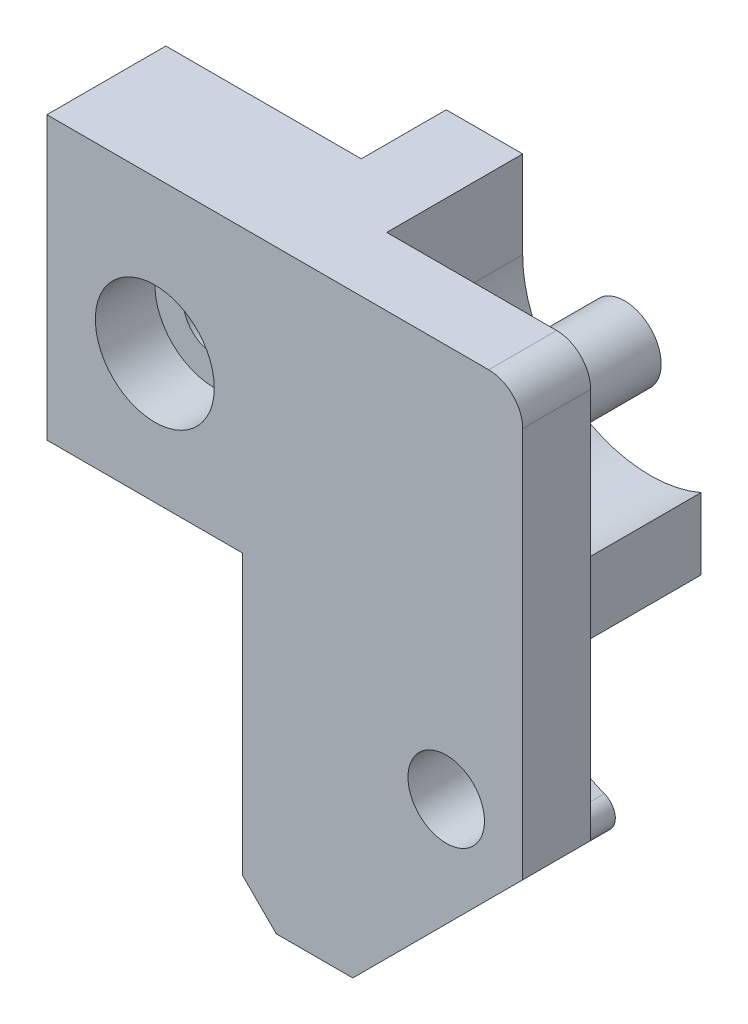
from build123d import *

# Parameters (mm, degrees)
BOSS_EXTRUDE1_DEPTH                            = 4
SKETCH2_R                                      = 2.25
CUT_EXTRUDE1_DEPTH                             = 46
SKETCH2_3_R                                    = 2.15
BOSS_EXTRUDE2_DEPTH                            = 8
BOSS_EXTRUDE4_DEPTH                            = 8
SKETCH6_W                                      = 11.5
SKETCH6_H                                      = 18.413961031
CUT_EXTRUDE2_DEPTH                             = 47.400431032
SKETCH12_W                                     = 8
SKETCH12_H                                     = 13.1
CUT_EXTRUDE3_DEPTH                             = 40.286161686
CBORE_FOR_6_SOCKET_HEAD_CAP_SCREW1_D           = 3.6576
CBORE_FOR_6_SOCKET_HEAD_CAP_SCREW1_CBORE_D     = 7
CBORE_FOR_6_SOCKET_HEAD_CAP_SCREW1_CBORE_DEPTH = 3.5052
SKETCH13_W                                     = 11.5
SKETCH13_H                                     = 16.586038969
CUT_EXTRUDE4_DEPTH                             = 5
CHAMFER1_SIZE                                  = 2
CUT_EXTRUDE5_START                             = -1.5
SKETCH14_R                                     = 2.15
CUT_EXTRUDE5_DEPTH                             = 1.5


with BuildPart() as part:
    # Sketch1 → Boss-Extrude1 (new body)
    with BuildSketch(Plane.XY):
        with BuildLine():
            Line((18, 0), (28, 10))
            Line((28, 10), (28, 33))
            ThreePointArc((28, 33), (27.414213562, 34.414213562), (26, 35))
            Line((26, 35), (0, 35))
            Line((0, 35), (0, 0))
            Line((0, 0), (18, 0))
        make_face()
    extrude(amount=BOSS_EXTRUDE1_DEPTH)

    # Sketch2 → Cut-Extrude1 (cut, through all)
    with BuildSketch(Plane(origin=(0, 0, 0), x_dir=(-1, 0, 0), z_dir=(0, 0, -1))):
        with Locations((-23.5, 11.863961031)):
            Circle(SKETCH2_R)
    extrude(amount=-CUT_EXTRUDE1_DEPTH, mode=Mode.SUBTRACT)

    # Sketch2<3> → Boss-Extrude2 (add)
    with BuildSketch(Plane(origin=(0, 0, 0), x_dir=(-1, 0, 0), z_dir=(0, 0, -1))):
        with Locations(Location((-23.5, 29.863961031, 0), (0, 0, 180))):
            Circle(SKETCH2_3_R)
    extrude(amount=BOSS_EXTRUDE2_DEPTH)

    # Sketch2<5> → Boss-Extrude4 (add)
    with BuildSketch(Plane(origin=(0, 0, 0), x_dir=(-1, 0, 0), z_dir=(0, 0, -1))):
        with BuildLine():
            ThreePointArc((-26.5, 18.792344681), (-23.077745882, 19.402143932), (-19.745003329, 18.413961031))
            Line((-19.745003329, 18.413961031), (-15.95, 18.413961031))
            Line((-15.95, 18.413961031), (-15.95, 5.313961031))
            Line((-15.95, 5.313961031), (-19.725, 5.313961031))
            ThreePointArc((-19.725, 5.313961031), (-20.25595921, 5.035394245), (-20.807324798, 4.799782009))
            ThreePointArc((-20.807324798, 4.799782009), (-21.429052247, 4.074422526), (-21.15825613, 3.15825613))
            Line((-21.15825613, 3.15825613), (-18, 0))
            Line((-18, 0), (0, 0))
            Line((0, 0), (0, 35))
            Line((0, 35), (-16, 35))
            Line((-16, 35), (-16, 29.863961031))
            ThreePointArc((-16, 29.863961031), (-19.392080819, 23.589010832), (-26.5, 22.990097488))
            Line((-26.5, 22.990097488), (-26.5, 18.792344681))
        make_face()
    extrude(amount=BOSS_EXTRUDE4_DEPTH)

    # Sketch6 → Cut-Extrude2 (cut, through all)
    with BuildSketch(Plane(origin=(0, 0, -8), x_dir=(-1, 0, 0), z_dir=(0, 0, -1))):
        with Locations((-5.75, 9.206980515)):
            Rectangle(SKETCH6_W, SKETCH6_H)
    extrude(amount=-CUT_EXTRUDE2_DEPTH, mode=Mode.SUBTRACT)

    # Sketch12 → Cut-Extrude3 (cut, through all)
    with BuildSketch(Plane(origin=(15.95, 0, 0), x_dir=(0, 0, -1), z_dir=(1, 0, 0))):
        with Locations((4, 11.863961031)):
            Rectangle(SKETCH12_W, SKETCH12_H)
    extrude(amount=-CUT_EXTRUDE3_DEPTH, mode=Mode.SUBTRACT)

    # CBORE for #6 Socket Head Cap Screw1 (through all)
    with Locations(Plane.XY.offset(4)):
        with Locations((6.35, 26)):
            CounterBoreHole(CBORE_FOR_6_SOCKET_HEAD_CAP_SCREW1_D / 2, CBORE_FOR_6_SOCKET_HEAD_CAP_SCREW1_CBORE_D / 2, CBORE_FOR_6_SOCKET_HEAD_CAP_SCREW1_CBORE_DEPTH)

    # Sketch13 → Cut-Extrude4 (cut)
    with BuildSketch(Plane(origin=(0, 0, -8), x_dir=(-1, 0, 0), z_dir=(0, 0, -1))):
        with Locations((-5.75, 26.706980515)):
            Rectangle(SKETCH13_W, SKETCH13_H)
    extrude(amount=-CUT_EXTRUDE4_DEPTH, mode=Mode.SUBTRACT)

    # Chamfer1
    chamfer1_edges = [part.edges().sort_by_distance(p)[0] for p in [
        (11.5, 0, -2),
    ]]
    chamfer(chamfer1_edges, length=CHAMFER1_SIZE)

    # Sketch14 → Cut-Extrude5 (cut)
    with BuildSketch(Plane(origin=(0, 0, -8), x_dir=(-1, 0, 0), z_dir=(0, 0, -1)).offset(CUT_EXTRUDE5_START)):
        with Locations(Location((-23.5, 29.863961031, 0), (0, 0, 180))):
            Circle(SKETCH14_R)
    extrude(amount=CUT_EXTRUDE5_DEPTH, mode=Mode.SUBTRACT)


solid = part.part
